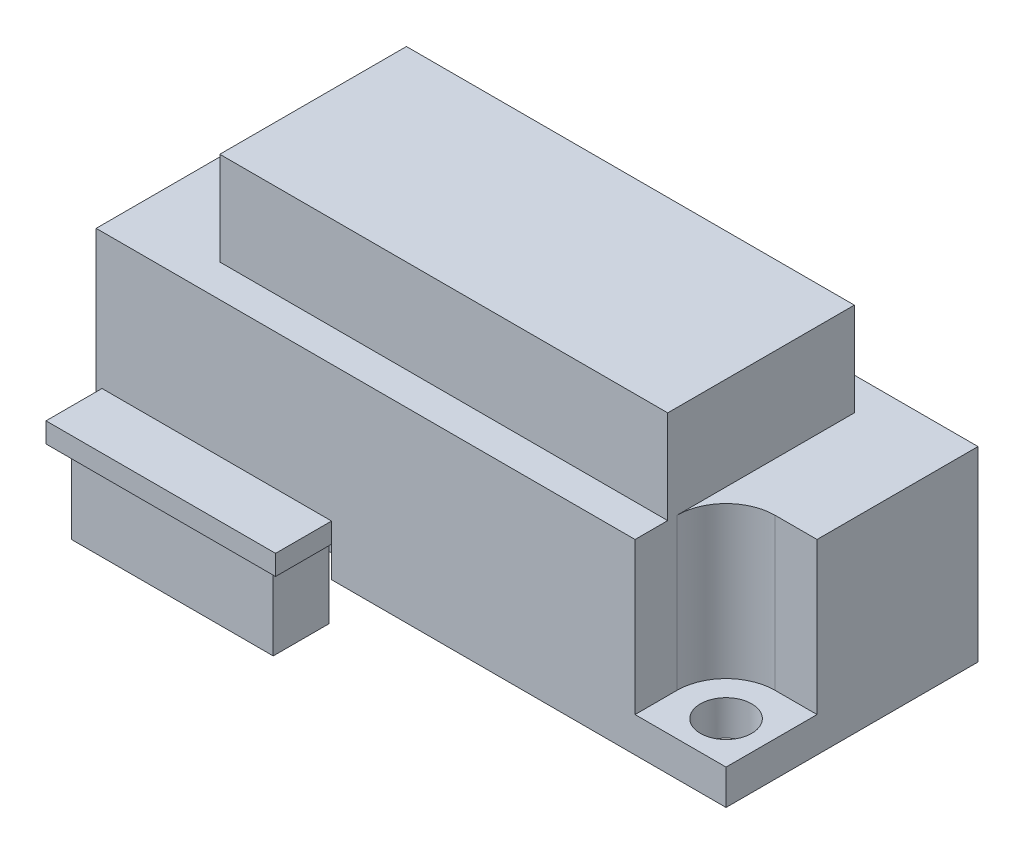
from build123d import *

# Parameters (mm, degrees)
SKETCH1_W                = 27
SKETCH1_H                = 10.8
BOSS_EXTRUDE1_DEPTH      = 12
SKETCH2_W                = 3.9
SKETCH2_H                = 10.8
CUT_EXTRUDE1_DEPTH       = 4
SKETCH3_W                = 3.9
SKETCH3_H                = 10.8
CUT_EXTRUDE2_DEPTH       = 4
CUT_EXTRUDE3_DEPTH       = 31.160238726
CUT_EXTRUDE3_DEPTH_BACK  = 31.160238726
SKETCH4_R                = 1.1
CUT_EXTRUDE4_DEPTH       = 31.160238726
CUT_EXTRUDE4_DEPTH_BACK  = 31.160238726
SKETCH5_R                = 1.1
CUT_EXTRUDE5_DEPTH       = 6.5
SKETCH7_OUTSIDE_W        = 35.292
SKETCH7_OUTSIDE_H        = 19.092
SKETCH7_OUTSIDE_W_2      = 19.2
SKETCH7_OUTSIDE_H_2      = 8
CUT_EXTRUDE6_DEPTH       = 4
BOSS_EXTRUDE2_DEPTH      = 2.18
BOSS_EXTRUDE2_DEPTH_BACK = 2.18
SKETCH8_W                = 9.84
SKETCH8_H                = 3.4
SKETCH9_W                = 9.84
SKETCH9_H                = 3.4
SKETCH9_W_2              = 8.64
SKETCH9_H_2              = 2.4
CUT_EXTRUDE7_DEPTH       = 3.5


with BuildPart() as part:
    # Sketch1 → Boss-Extrude1 (new body)
    with BuildSketch(Plane(origin=(0, 0, 0), x_dir=(1, 0, 0), z_dir=(0, 1, 0))):
        with Locations((13.5, 5.4)):
            Rectangle(SKETCH1_W, SKETCH1_H)
    extrude(amount=BOSS_EXTRUDE1_DEPTH)

    # Sketch2 → Cut-Extrude1 (cut)
    with BuildSketch(Plane(origin=(0, 12, 0), x_dir=(1, 0, 0), z_dir=(0, 1, 0))):
        with Locations((1.95, 5.4)):
            Rectangle(SKETCH2_W, SKETCH2_H)
    extrude(amount=-CUT_EXTRUDE1_DEPTH, mode=Mode.SUBTRACT)

    # Sketch3 → Cut-Extrude2 (cut)
    with BuildSketch(Plane(origin=(0, 12, 0), x_dir=(1, 0, 0), z_dir=(0, 1, 0))):
        with Locations((25.05, 5.4)):
            Rectangle(SKETCH3_W, SKETCH3_H)
    extrude(amount=-CUT_EXTRUDE2_DEPTH, mode=Mode.SUBTRACT)

    # Sketch4 → Cut-Extrude3 (cut, two sides: drawn at the far end of the back side and taken through both)
    with BuildSketch(Plane(origin=(0, 8, 0), x_dir=(1, 0, 0), z_dir=(0, 1, 0)).offset(-CUT_EXTRUDE3_DEPTH_BACK)):
        with Locations(Location((25.2, 1.8, 0), (0, 0, 270))):
            Circle(SKETCH4_R)
    extrude(amount=CUT_EXTRUDE3_DEPTH + CUT_EXTRUDE3_DEPTH_BACK, mode=Mode.SUBTRACT)

    # Sketch5 → Cut-Extrude4 (cut, two sides: drawn at the far end of the back side and taken through both)
    with BuildSketch(Plane(origin=(0, 8, 0), x_dir=(1, 0, 0), z_dir=(0, 1, 0)).offset(-CUT_EXTRUDE4_DEPTH_BACK)):
        with Locations(Location((1.8, 9, 0), (0, 0, 270))):
            Circle(SKETCH5_R)
    extrude(amount=CUT_EXTRUDE4_DEPTH + CUT_EXTRUDE4_DEPTH_BACK, mode=Mode.SUBTRACT)

    # Sketch6 → Cut-Extrude5 (cut)
    with BuildSketch(Plane(origin=(0, 8, 0), x_dir=(1, 0, 0), z_dir=(0, 1, 0))):
        with BuildLine():
            Line((1.8, 6.9), (0, 6.9))
            Line((0, 6.9), (0, 10.8))
            Line((0, 10.8), (3.9, 10.8))
            Line((3.9, 10.8), (3.9, 9))
            ThreePointArc((3.9, 9), (3.28492424, 7.51507576), (1.8, 6.9))
        make_face()
        with BuildLine():
            Line((25.2, 3.9), (27, 3.9))
            Line((27, 3.9), (27, 0))
            Line((27, 0), (23.1, 0))
            Line((23.1, 0), (23.1, 1.8))
            ThreePointArc((23.1, 1.8), (23.71507576, 3.28492424), (25.2, 3.9))
        make_face()
    extrude(amount=-CUT_EXTRUDE5_DEPTH, mode=Mode.SUBTRACT)

    # Sketch7 outside → Cut-Extrude6 (cut)
    with BuildSketch(Plane(origin=(0, 12, 0), x_dir=(1, 0, 0), z_dir=(0, 1, 0))):
        with Locations((13.5, 5.4)):
            Rectangle(SKETCH7_OUTSIDE_W, SKETCH7_OUTSIDE_H)
        with Locations((13.5, 5.4)):
            Rectangle(SKETCH7_OUTSIDE_W_2, SKETCH7_OUTSIDE_H_2, mode=Mode.SUBTRACT)
    extrude(amount=-CUT_EXTRUDE6_DEPTH, mode=Mode.SUBTRACT)

    # Sketch8 → Boss-Extrude2 (add, two sides: drawn at the far end of the back side and taken through both)
    with BuildSketch(Plane.XZ.offset(-BOSS_EXTRUDE2_DEPTH_BACK)):
        with Locations((5.17, 0.7)):
            Rectangle(SKETCH8_W, SKETCH8_H)
    extrude(amount=BOSS_EXTRUDE2_DEPTH + BOSS_EXTRUDE2_DEPTH_BACK)

    # Sketch9 → Cut-Extrude7 (cut)
    with BuildSketch(Plane.XZ.offset(2.18)):
        with Locations((5.17, 0.7)):
            Rectangle(SKETCH9_W, SKETCH9_H)
        with Locations((5.17, 0.7)):
            Rectangle(SKETCH9_W_2, SKETCH9_H_2, mode=Mode.SUBTRACT)
    extrude(amount=-CUT_EXTRUDE7_DEPTH, mode=Mode.SUBTRACT)


solid = part.part
